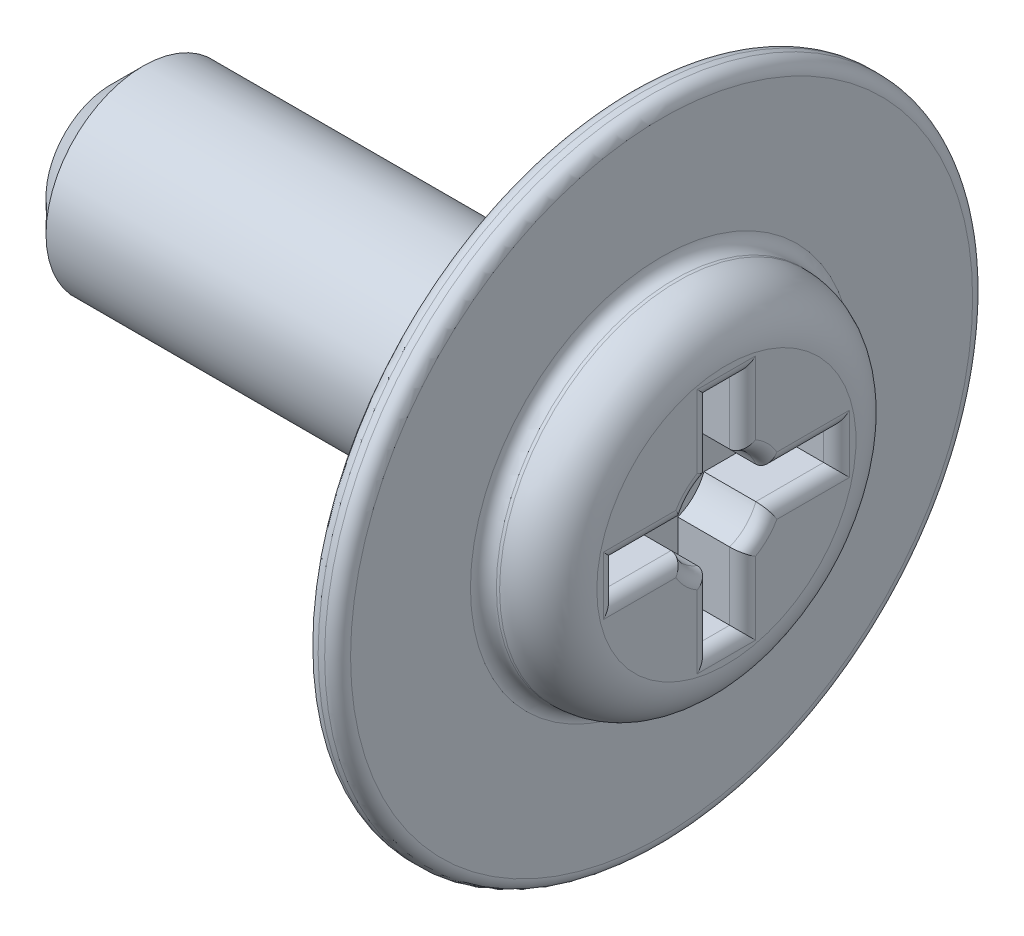
from build123d import *

# Parameters (mm, degrees)
ESQUISSE2_W                  = 0.5
ESQUISSE2_H                  = 1.7
ENL_V_MAT_EXTRU_1_DEPTH      = 1
R_P_TITION_CIRCULAIRE1_COUNT = 4
ESQUISSE3_R                  = 0.699771755
ENL_V_MAT_EXTRU_2_DEPTH      = 1
CHANFREIN1_SIZE              = 0.5
CONG_1_R                     = 0.2


with BuildPart() as part:
    # Esquisse1 → Révolution1 (revolve)
    with BuildSketch(Plane.XY, mode=Mode.PRIVATE) as r_volution1_sk:
        with BuildLine():
            Line((0, 0), (0, 1.5))
            Line((0, 1.5), (8, 1.5))
            Line((8, 1.5), (8, 5))
            Line((8, 5), (8.5, 5))
            Line((8.5, 5), (8.5, 2.75))
            Line((8.5, 2.75), (8.75, 2.75))
            ThreePointArc((8.75, 2.75), (9.280330086, 2.530330086), (9.5, 2))
            Line((9.5, 2), (9.5, 0))
            Line((9.5, 0), (0, 0))
        make_face()
    revolve(r_volution1_sk.sketch.rotate(Axis((0, 0, 0), (1, 0, 0)), 90), axis=Axis((0, 0, 0), (1, 0, 0)))

    # Esquisse2 → Enlèv. mat.-Extru.1 (cut)
    with BuildSketch(Plane(origin=(9.5, 0, 0), x_dir=(0, 0, -1), z_dir=(1, 0, 0))):
        with Locations((0, 0.85)):
            Rectangle(ESQUISSE2_W, ESQUISSE2_H)
    enl_v_mat_extru_1 = extrude(amount=-ENL_V_MAT_EXTRU_1_DEPTH, mode=Mode.SUBTRACT)

    # Répétition circulaire1: Enlèv. mat.-Extru.1 ×4 about axis
    r_p_tition_circulaire1_axis = Axis((0, 0, 0), (1, 0, 0))
    for i in range(1, R_P_TITION_CIRCULAIRE1_COUNT):
        add(enl_v_mat_extru_1.rotate(r_p_tition_circulaire1_axis, i * 360 / R_P_TITION_CIRCULAIRE1_COUNT), mode=Mode.SUBTRACT)

    # Esquisse3 → Enlèv. mat.-Extru.2 (cut)
    with BuildSketch(Plane(origin=(9.5, 0, 0), x_dir=(0, 0, -1), z_dir=(1, 0, 0))):
        Circle(ESQUISSE3_R)
    extrude(amount=-ENL_V_MAT_EXTRU_2_DEPTH, mode=Mode.SUBTRACT)

    # Chanfrein1
    chanfrein1_edges = [part.edges().sort_by_distance(p)[0] for p in [
        (0, 0, -1.5),
    ]]
    chamfer(chanfrein1_edges, length=CHANFREIN1_SIZE)

    # Congé1
    cong_1_edges = [part.edges().sort_by_distance(p)[0] for p in [
        (8, 0, -5),
        (8.5, 0, -5),
        (8.5, 0, -2.75),
        (9.5, 0, 1.7),
        (9.5, -0.25, 1.176795238),
        (9.5, -0.494813353, 0.494813353),
        (9.5, -1.176795238, 0.25),
        (9.5, -1.7, 0),
        (9.5, -1.176795238, -0.25),
        (9.5, -0.494813353, -0.494813353),
        (9.5, -0.25, -1.176795238),
        (9.5, 0, -1.7),
        (9.5, 0.25, -1.176795238),
        (9.5, 0.494813353, -0.494813353),
        (9.5, 1.176795238, -0.25),
        (9.5, 1.7, 0),
        (9.5, 1.176795238, 0.25),
        (9.5, 0.494813353, 0.494813353),
        (9.5, 0.25, 1.176795238),
    ]]
    fillet(cong_1_edges, radius=CONG_1_R)


solid = part.part
